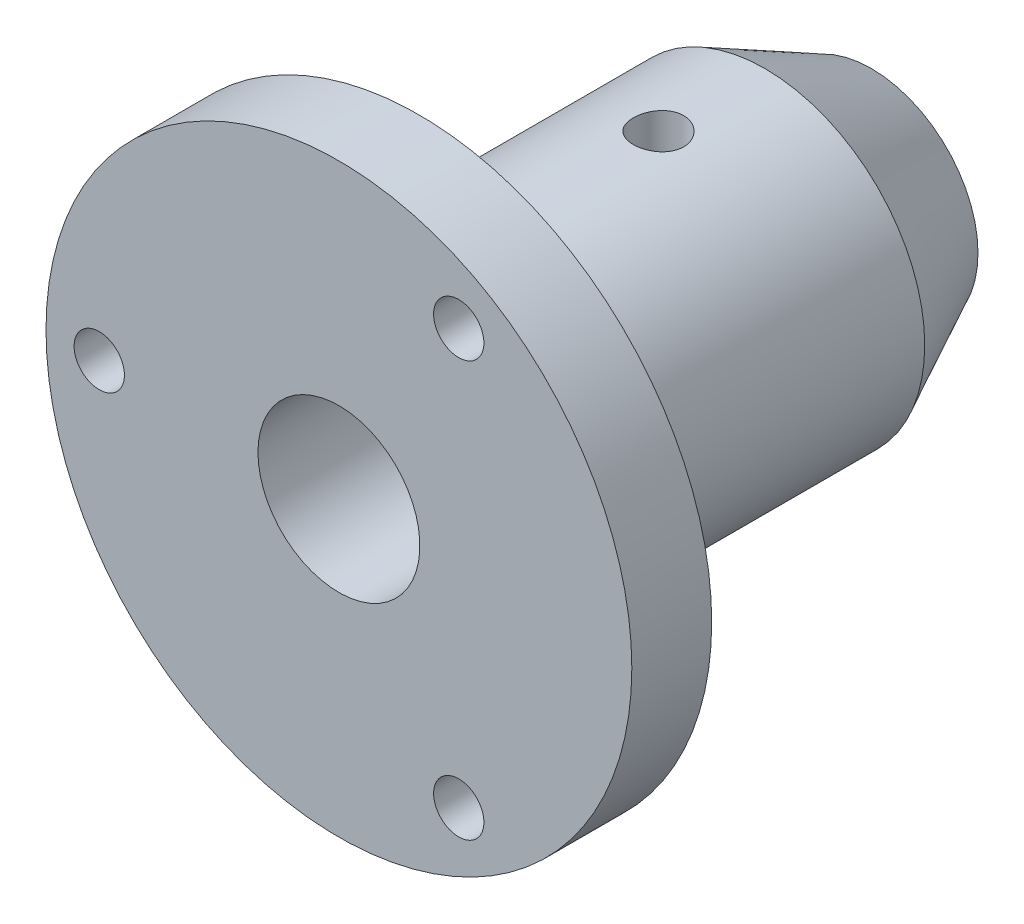
from build123d import *

# Parameters (mm, degrees)
SKETCH1_R               = 9.525
BOSS_EXTRUDE1_DEPTH     = 31.75
SKETCH18_R              = 17.4625
BOSS_EXTRUDE2_DEPTH     = 4.7625
SKETCH12_R              = 4.826
CUT_EXTRUDE3_DEPTH      = 31.75
CUT_EXTRUDE4_DEPTH      = 41.223628783
CUT_EXTRUDE4_DEPTH_BACK = 41.223628783
SKETCH14_R              = 1.5
SKETCH17_R              = 1.499997
CUT_EXTRUDE5_DEPTH      = 6.35
CIRPATTERN1_COUNT       = 3
FILLET1_R               = 1.5875


with BuildPart() as part:
    # Sketch1 → Boss-Extrude1 (new body)
    with BuildSketch(Plane.XY):
        Circle(SKETCH1_R)
    extrude(amount=BOSS_EXTRUDE1_DEPTH)

    # Sketch18 → Boss-Extrude2 (add)
    with BuildSketch(Plane.XY.offset(31.75)):
        Circle(SKETCH18_R)
    extrude(amount=-BOSS_EXTRUDE2_DEPTH)

    # Sketch12 → Cut-Extrude3 (cut)
    with BuildSketch(Plane(origin=(0, 0, 0), x_dir=(-1, 0, 0), z_dir=(0, 0, -1))):
        Circle(SKETCH12_R)
    extrude(amount=-CUT_EXTRUDE3_DEPTH, mode=Mode.SUBTRACT)

    # Sketch14 → Cut-Extrude4 (cut, two sides: drawn at the far end of the back side and taken through both)
    with BuildSketch(Plane(origin=(0, 0, 0), x_dir=(1, 0, 0), z_dir=(0, 1, 0)).offset(-CUT_EXTRUDE4_DEPTH_BACK)):
        with Locations(Location((0, -12.7, 0), (0, 0, 270))):
            Circle(SKETCH14_R)
        with Locations(Location((0, -22.225, 0), (0, 0, 270))):
            Circle(SKETCH14_R)
    extrude(amount=CUT_EXTRUDE4_DEPTH + CUT_EXTRUDE4_DEPTH_BACK, mode=Mode.SUBTRACT)

    # Sketch17 → Cut-Extrude5 (cut)
    with BuildSketch(Plane.XY.offset(31.75)):
        with Locations((7.14375, 12.373337957)):
            Circle(SKETCH17_R)
    cut_extrude5 = extrude(amount=-CUT_EXTRUDE5_DEPTH, mode=Mode.SUBTRACT)

    # CirPattern1: Cut-Extrude5 ×3 about axis
    cirpattern1_axis = Axis((0, 0, 0), (0, 0, 1))
    for i in range(1, CIRPATTERN1_COUNT):
        add(cut_extrude5.rotate(cirpattern1_axis, i * 360 / CIRPATTERN1_COUNT), mode=Mode.SUBTRACT)

    # Sketch16 → Cut-Revolve1 (revolve, cut)
    with BuildSketch(Plane(origin=(0, 0, 0), x_dir=(1, 0, 0), z_dir=(0, 1, 0))):
        Polygon((-6.35, 0), (-9.525, -6.35), (-9.525, 0), align=None)
    revolve(axis=Axis((0, 0, 0), (0, 0, 1)), mode=Mode.SUBTRACT)

    # Fillet1
    fillet1_edges = [part.edges().sort_by_distance(p)[0] for p in [
        (-9.525, 0, 26.9875),
    ]]
    fillet(fillet1_edges, radius=FILLET1_R)


solid = part.part
